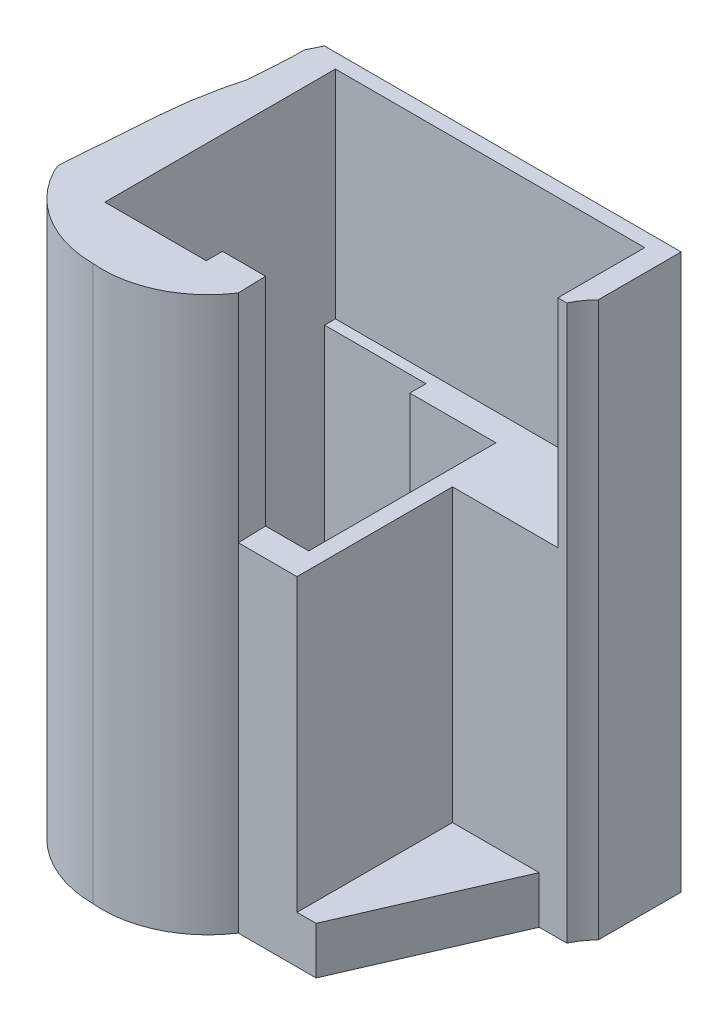
from build123d import *

# Parameters (mm, degrees)
BOSS_EXTRUDE1_DEPTH = 82
CUT_EXTRUDE1_DEPTH  = 105
SKETCH7_W           = 23
SKETCH7_H           = 43
CUT_EXTRUDE3_DEPTH  = 28
CUT_EXTRUDE4_DEPTH  = 32
CUT_EXTRUDE5_DEPTH  = 32
CUT_EXTRUDE6_DEPTH  = 32


with BuildPart() as part:
    # Sketch1 → Boss-Extrude1 (new body)
    with BuildSketch(Plane(origin=(0, 0, 0), x_dir=(1, 0, 0), z_dir=(0, 1, 0))):
        with BuildLine():
            Line((-21.9286378, 20.529965557), (30.819410356, 20.529965557))
            Line((30.819410356, 20.529965557), (30.819410356, 8.269460429))
            ThreePointArc((30.819410356, 8.269460429), (29.737157279, 6.984989328), (28.898083391, 5.52996605))
            Line((28.898083391, 5.52996605), (24.81959218, 5.52996605))
            Line((24.81959218, 5.52996605), (14.820019426, -17.47003395))
            Line((14.820019426, -17.47003395), (3.320446672, -17.47003395))
            ThreePointArc((3.320446672, -17.47003395), (-2.977277813, -22.983126936), (-11.218310652, -24.446310348))
            ThreePointArc((-11.218310652, -24.446310348), (-19.829053504, -21.990642561), (-25.924914656, -15.432009048))
            Line((-25.924914656, -15.432009048), (-26.328479109, -14.47003395))
            Line((-26.328479109, -14.47003395), (-25.288623152, -0.544399566))
            Line((-25.288623152, -0.544399566), (-24.844287214, 3.45451706))
            Line((-24.844287214, 3.45451706), (-24.102893172, 7.451406174))
            Line((-24.102893172, 7.451406174), (-23.328601179, 10.529965096))
            Line((-23.328601179, 10.529965096), (-22.928576765, 16.529967242))
            Line((-22.928576765, 16.529967242), (-22.928576765, 18.529964858))
            Line((-22.928576765, 18.529964858), (-21.9286378, 20.529965557))
        make_face()
    extrude(amount=BOSS_EXTRUDE1_DEPTH)

    # Sketch2 → Cut-Extrude1 (cut)
    with BuildSketch(Plane.XZ):
        Polygon((-18.173439963, -16.784486826), (-18.173439963, 15.715513413), (-3.173989279, 15.715513413), (-3.173989279, 13.315508549), (9.57552244, 13.315508549), (9.57552244, -14.3844853), (-3.173989279, -14.3844853), (-3.173989279, -16.784486826), align=None)
    extrude(amount=-CUT_EXTRUDE1_DEPTH, mode=Mode.SUBTRACT)

    # Sketch7 → Cut-Extrude3 (cut)
    with BuildSketch(Plane(origin=(40, 0, 0), x_dir=(0, 0, -1), z_dir=(1, 0, 0))):
        with Locations((-5.97003395, 28.5)):
            Rectangle(SKETCH7_W, SKETCH7_H)
    extrude(amount=-CUT_EXTRUDE3_DEPTH, mode=Mode.SUBTRACT)

    # Sketch9 → Cut-Extrude4 (cut)
    with BuildSketch(Plane(origin=(0, 82, 0), x_dir=(1, 0, 0), z_dir=(0, 1, 0))):
        Polygon((14.820019426, -17.47003395), (24.81959218, 5.52996605), (15.399238031, 5.52996605), align=None)
    extrude(amount=-CUT_EXTRUDE4_DEPTH, mode=Mode.SUBTRACT)

    # Sketch10 → Cut-Extrude5 (cut)
    with BuildSketch(Plane(origin=(0, 82, 0), x_dir=(1, 0, 0), z_dir=(0, 1, 0))):
        Polygon((3.320446672, -17.47003395), (3.20076658, -13.315508549), (9.57552244, -13.315508549), (9.57552244, 14.3844853), (9.57552244, 18.3844853), (27.57552244, 18.3844853), (27.57552244, 9.3844853), (27.57552244, 5.52996605), (15.399238031, 5.52996605), (14.820019426, -17.47003395), align=None)
    extrude(amount=-CUT_EXTRUDE5_DEPTH, mode=Mode.SUBTRACT)

    # Sketch12 → Cut-Extrude6 (cut)
    with BuildSketch(Plane(origin=(0, 82, 0), x_dir=(1, 0, 0), z_dir=(0, 1, 0))):
        Polygon((9.57552244, 14.3844853), (-3.173989279, 14.3844853), (-3.173989279, 16.784486826), (-18.173439963, 16.784486826), (-18.173439963, 18.3844853), (9.57552244, 18.3844853), align=None)
    extrude(amount=-CUT_EXTRUDE6_DEPTH, mode=Mode.SUBTRACT)


solid = part.part
